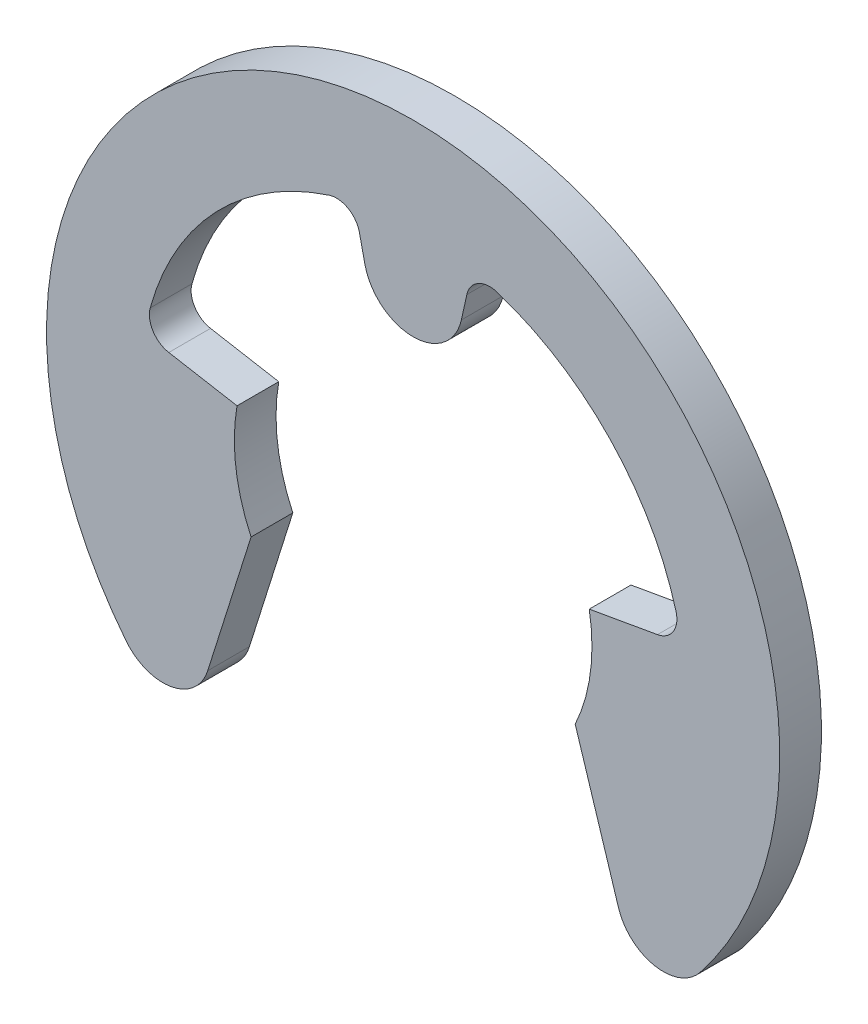
from build123d import *

# Parameters (mm, degrees)
BODY_DEPTH = 0.7


with BuildPart() as part:
    # BodySke → Body (new body)
    with BuildSketch(Plane.XY):
        with BuildLine():
            Line((2.954423259, 0.520944533), (4.099428621, 0.722839871))
            ThreePointArc((4.099428621, 0.722839871), (4.363883059, 0.900217065), (4.410660695, 1.215194321))
            ThreePointArc((4.410660695, 1.215194321), (3.304815126, 3.16367223), (1.406428042, 4.353456691))
            ThreePointArc((1.406428042, 4.353456691), (1.089710164, 4.320462692), (0.900966453, 4.063997041))
            Line((0.900966453, 4.063997041), (0.80903451, 3.649318842))
            ThreePointArc((0.80903451, 3.649318842), (0, 3), (-0.80903451, 3.649318842))
            Line((-0.80903451, 3.649318842), (-0.900966453, 4.063997041))
            ThreePointArc((-0.900966453, 4.063997041), (-1.089710164, 4.320462692), (-1.406428042, 4.353456691))
            ThreePointArc((-1.406428042, 4.353456691), (-3.304815126, 3.16367223), (-4.410660695, 1.215194321))
            ThreePointArc((-4.410660695, 1.215194321), (-4.363883059, 0.900217065), (-4.099428621, 0.722839871))
            Line((-4.099428621, 0.722839871), (-2.954423259, 0.520944533))
            ThreePointArc((-2.954423259, 0.520944533), (-2.974334584, -0.391578577), (-2.718923361, -1.267854785))
            Line((-2.718923361, -1.267854785), (-3.446179756, -3.574417389))
            ThreePointArc((-3.446179756, -3.574417389), (-4.053778864, -4.111935463), (-4.813608561, -3.827750334))
            ThreePointArc((-4.813608561, -3.827750334), (0, 6.15), (4.813608561, -3.827750334))
            ThreePointArc((4.813608561, -3.827750334), (4.053778864, -4.111935463), (3.446179756, -3.574417389))
            Line((3.446179756, -3.574417389), (2.718923361, -1.267854785))
            ThreePointArc((2.718923361, -1.267854785), (2.974334584, -0.391578577), (2.954423259, 0.520944533))
        make_face()
    extrude(amount=-BODY_DEPTH)


solid = part.part
